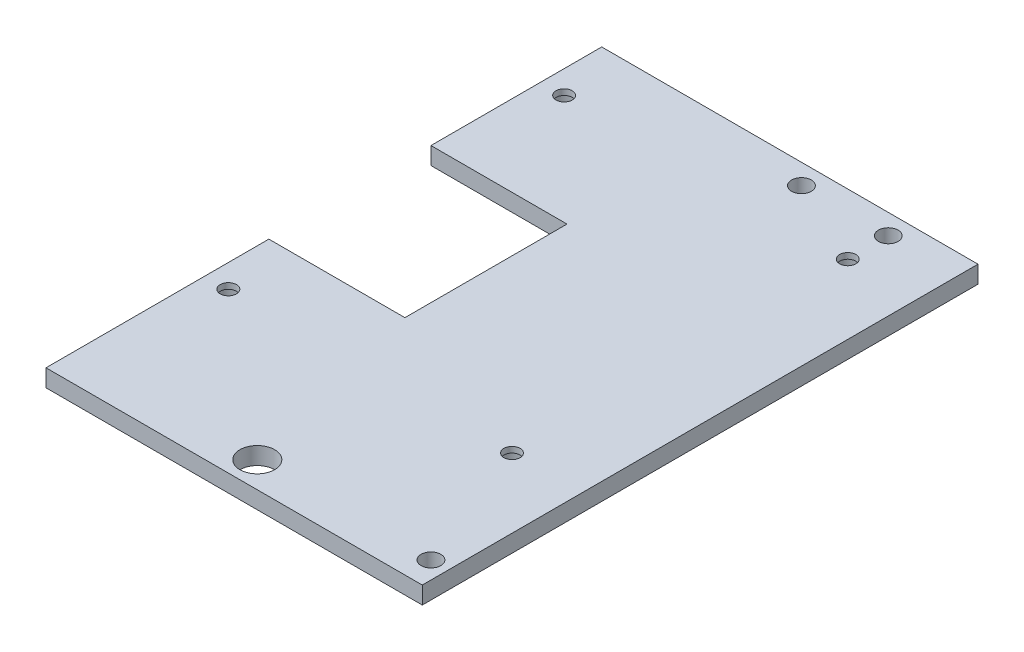
from build123d import *

# Parameters (mm, degrees)
ESQUISSE1_R             = 1.7
ESQUISSE1_R_2           = 3
ESQUISSE1_R_3           = 1.4
BOSS_EXTRU_1_DEPTH      = 3
ESQUISSE1_3_R           = 2.4
ESQUISSE1_3_R_2         = 1.4
ENL_V_MAT_EXTRU_1_DEPTH = 2


with BuildPart() as part:
    # Esquisse1 → Boss.-Extru.1 (new body)
    with BuildSketch(Plane(origin=(0, 0, 0), x_dir=(1, 0, 0), z_dir=(0, 1, 0))):
        Polygon((19.5, 48), (-45.5, 48), (-45.5, 18.5), (-22, 18.5), (-22, -9.5), (-45.5, -9.5), (-45.5, -48), (19.5, -48), align=None)
        with Locations(Location((16.5, -43.5, 0), (0, 0, 270))):
            Circle(ESQUISSE1_R, mode=Mode.SUBTRACT)
        with Locations(Location((7.5, 44.5, 0), (0, 0, 270))):
            Circle(ESQUISSE1_R, mode=Mode.SUBTRACT)
        with Locations(Location((-7.5, 44.5, 0), (0, 0, 270))):
            Circle(ESQUISSE1_R, mode=Mode.SUBTRACT)
        with Locations(Location((-13.5, -43.5, 0), (0, 0, 270))):
            Circle(ESQUISSE1_R_2, mode=Mode.SUBTRACT)
        with Locations(Location((-41.5, -20.5, 0), (0, 0, 270))):
            Circle(ESQUISSE1_R_3, mode=Mode.SUBTRACT)
        with Locations(Location((7.5, -20.5, 0), (0, 0, 270))):
            Circle(ESQUISSE1_R_3, mode=Mode.SUBTRACT)
        with Locations(Location((7.5, 37.5, 0), (0, 0, 270))):
            Circle(ESQUISSE1_R_3, mode=Mode.SUBTRACT)
        with Locations(Location((-41.5, 37.5, 0), (0, 0, 270))):
            Circle(ESQUISSE1_R_3, mode=Mode.SUBTRACT)
    extrude(amount=BOSS_EXTRU_1_DEPTH)

    # Esquisse1<3> → Enlèv. mat.-Extru.1 (cut)
    # profile 1 of 4: a face of its own
    with BuildSketch(Plane(origin=(0, 0, 0), x_dir=(1, 0, 0), z_dir=(0, 1, 0))):
        with Locations(Location((-41.5, -20.5, 0), (0, 0, 270))):
            Circle(ESQUISSE1_3_R)
        with Locations(Location((-41.5, -20.5, 0), (0, 0, 270))):
            Circle(ESQUISSE1_3_R_2, mode=Mode.SUBTRACT)
    # profile 2 of 4: a face of its own
    with BuildSketch(Plane(origin=(0, 0, 0), x_dir=(1, 0, 0), z_dir=(0, 1, 0))):
        with Locations(Location((7.5, -20.5, 0), (0, 0, 270))):
            Circle(ESQUISSE1_3_R)
        with Locations(Location((7.5, -20.5, 0), (0, 0, 270))):
            Circle(ESQUISSE1_3_R_2, mode=Mode.SUBTRACT)
    # profile 3 of 4: a face of its own
    with BuildSketch(Plane(origin=(0, 0, 0), x_dir=(1, 0, 0), z_dir=(0, 1, 0))):
        with Locations(Location((7.5, 37.5, 0), (0, 0, 270))):
            Circle(ESQUISSE1_3_R)
        with Locations(Location((7.5, 37.5, 0), (0, 0, 270))):
            Circle(ESQUISSE1_3_R_2, mode=Mode.SUBTRACT)
    # profile 4 of 4: a face of its own
    with BuildSketch(Plane(origin=(0, 0, 0), x_dir=(1, 0, 0), z_dir=(0, 1, 0))):
        with Locations(Location((-41.5, 37.5, 0), (0, 0, 270))):
            Circle(ESQUISSE1_3_R)
        with Locations(Location((-41.5, 37.5, 0), (0, 0, 270))):
            Circle(ESQUISSE1_3_R_2, mode=Mode.SUBTRACT)
    extrude(amount=ENL_V_MAT_EXTRU_1_DEPTH, mode=Mode.SUBTRACT)


solid = part.part
